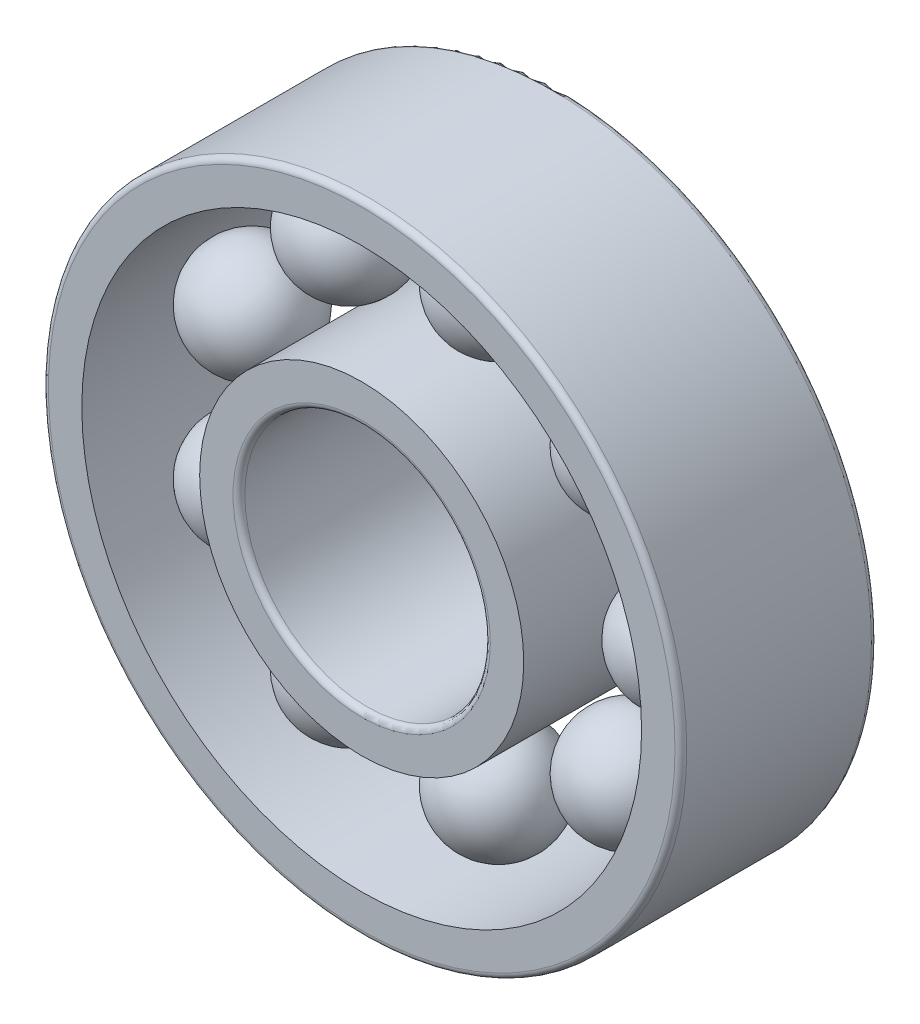
from build123d import *

# Parameters (mm, degrees)
INNERS_W           = 1.6
INNERS_H           = 8
OUTERS_W           = 1.6
OUTERS_H           = 8
BALLSPATTERN_COUNT = 9
FILLET_F1_R        = 0.24
FILLET_F2_R        = 0.24


with BuildPart() as part:
    # InnerS → InnerRing (revolve)
    with BuildSketch(Plane(origin=(0, 0, 0), x_dir=(1, 0, 0), z_dir=(0, 1, 0))):
        with Locations((5.8, 0)):
            Rectangle(INNERS_W, INNERS_H)
    revolve(axis=Axis((0, 0, 7), (0, 0, -1)))

    # Fillet F2
    fillet_f2_edges = [part.edges().sort_by_distance(p)[0] for p in [
        (-5, 0, -4),
        (-5, 0, 4),
    ]]
    fillet(fillet_f2_edges, radius=FILLET_F2_R)


with BuildPart() as body_2:
    # OuterS → OuterRing (revolve)
    with BuildSketch(Plane(origin=(0, 0, 0), x_dir=(1, 0, 0), z_dir=(0, 1, 0))):
        with Locations((12.2, 0)):
            Rectangle(OUTERS_W, OUTERS_H)
    revolve(axis=Axis((0, 0, 7), (0, 0, -1)))

    # Fillet F1
    fillet_f1_edges = [body_2.edges().sort_by_distance(p)[0] for p in [
        (-13, 0, -4),
        (-13, 0, 4),
    ]]
    fillet(fillet_f1_edges, radius=FILLET_F1_R)


with BuildPart() as body_3:
    # BallS → Ball (revolve)
    with BuildSketch(Plane(origin=(0, 0, 0), x_dir=(1, 0, 0), z_dir=(0, 1, 0))):
        with BuildLine():
            Line((6.72, 0), (11.28, 0))
            ThreePointArc((11.28, 0), (9, -2.28), (6.72, 0))
        make_face()
    revolve(axis=Axis((6.72, 0, 0), (1, 0, 0)))


with BuildPart() as ballspattern_1:
    # BallsPattern: pattern copy
    add(body_3.part.rotate(Axis((0, 0, -4.4), (0, 0, 1)), 1 * 360 / BALLSPATTERN_COUNT))


with BuildPart() as ballspattern_2:
    # BallsPattern: pattern copy
    add(body_3.part.rotate(Axis((0, 0, -4.4), (0, 0, 1)), 2 * 360 / BALLSPATTERN_COUNT))


with BuildPart() as ballspattern_3:
    # BallsPattern: pattern copy
    add(body_3.part.rotate(Axis((0, 0, -4.4), (0, 0, 1)), 3 * 360 / BALLSPATTERN_COUNT))


with BuildPart() as ballspattern_4:
    # BallsPattern: pattern copy
    add(body_3.part.rotate(Axis((0, 0, -4.4), (0, 0, 1)), 4 * 360 / BALLSPATTERN_COUNT))


with BuildPart() as ballspattern_5:
    # BallsPattern: pattern copy
    add(body_3.part.rotate(Axis((0, 0, -4.4), (0, 0, 1)), 5 * 360 / BALLSPATTERN_COUNT))


with BuildPart() as ballspattern_6:
    # BallsPattern: pattern copy
    add(body_3.part.rotate(Axis((0, 0, -4.4), (0, 0, 1)), 6 * 360 / BALLSPATTERN_COUNT))


with BuildPart() as ballspattern_7:
    # BallsPattern: pattern copy
    add(body_3.part.rotate(Axis((0, 0, -4.4), (0, 0, 1)), 7 * 360 / BALLSPATTERN_COUNT))


with BuildPart() as ballspattern_8:
    # BallsPattern: pattern copy
    add(body_3.part.rotate(Axis((0, 0, -4.4), (0, 0, 1)), 8 * 360 / BALLSPATTERN_COUNT))


solid = Compound([part.part, body_2.part, body_3.part, ballspattern_1.part, ballspattern_2.part, ballspattern_3.part, ballspattern_4.part, ballspattern_5.part, ballspattern_6.part, ballspattern_7.part, ballspattern_8.part])
